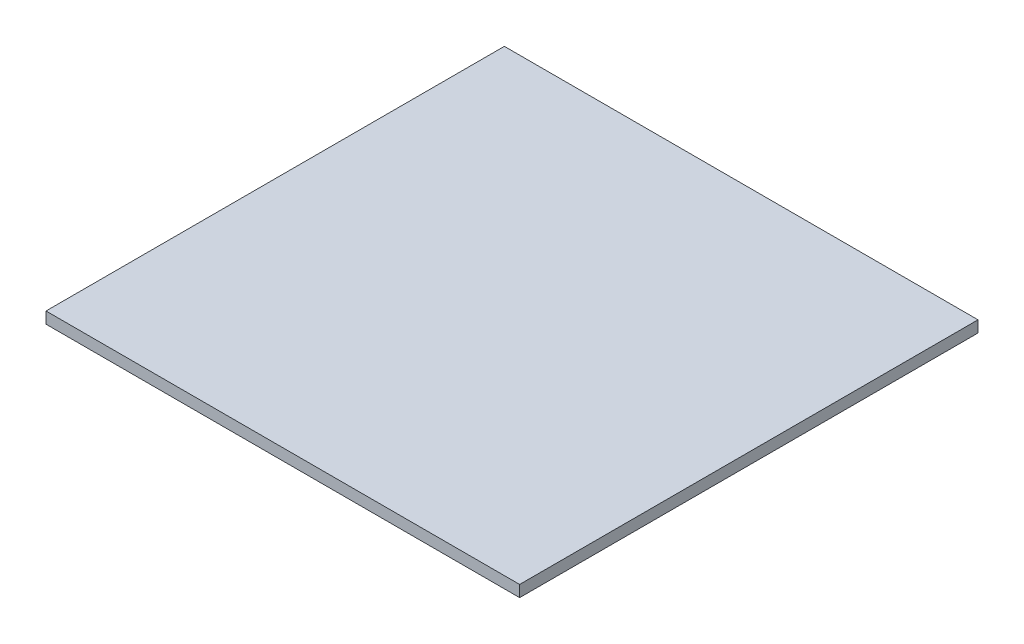
from build123d import *

# Parameters (mm, degrees)
ESBO_O1_W                = 600
ESBO_O1_H                = 600
RESSALTO_EXTRUS_O1_DEPTH = 15
SKETCH1_W                = 600
SKETCH1_H                = 15
BOSS_EXTRUDE1_DEPTH      = 20


with BuildPart() as part:
    # Esboço1 → Ressalto-extrusão1 (new body)
    with BuildSketch(Plane(origin=(0, 0, 0), x_dir=(1, 0, 0), z_dir=(0, 1, 0))):
        Rectangle(ESBO_O1_W, ESBO_O1_H)
    extrude(amount=RESSALTO_EXTRUS_O1_DEPTH)

    # Sketch1 → Boss-Extrude1 (add)
    with BuildSketch(Plane(origin=(300, 0, 0), x_dir=(0, 0, -1), z_dir=(1, 0, 0))):
        with Locations((0, 7.5)):
            Rectangle(SKETCH1_W, SKETCH1_H)
    extrude(amount=BOSS_EXTRUDE1_DEPTH)


solid = part.part
